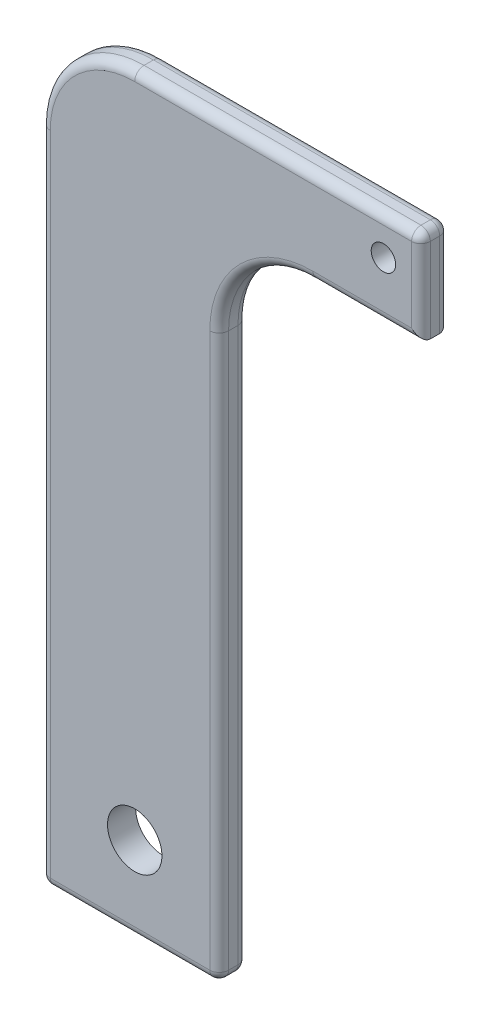
from build123d import *

# Parameters (mm, degrees)
ESQUISSE1_W        = 19
ESQUISSE1_H        = 70
ESQUISSE1_R        = 2.9
ESQUISSE1_H_2      = 10
ESQUISSE1_W_2      = 21.5
ESQUISSE1_R_2      = 1.3
BOSS_EXTRU_1_DEPTH = 3
CONG_1_R           = 10
CONG_2_R           = 1


with BuildPart() as part:
    # Esquisse1 → Boss.-Extru.1 (new body)
    # profile 1 of 3: a face of its own
    with BuildSketch(Plane.XY.offset(23)):
        with Locations((9.5, 112)):
            Rectangle(ESQUISSE1_W, ESQUISSE1_H)
        with Locations((10, 86)):
            Circle(ESQUISSE1_R, mode=Mode.SUBTRACT)
    # profile 2 of 3: a face of its own
    with BuildSketch(Plane.XY.offset(23)):
        with Locations((9.5, 152)):
            Rectangle(ESQUISSE1_W, ESQUISSE1_H_2)
    # profile 3 of 3: a face of its own
    with BuildSketch(Plane.XY.offset(23)):
        with Locations((29.75, 152)):
            Rectangle(ESQUISSE1_W_2, ESQUISSE1_H_2)
        with Locations((36.5, 153)):
            Circle(ESQUISSE1_R_2, mode=Mode.SUBTRACT)
    extrude(amount=BOSS_EXTRU_1_DEPTH)

    # Congé1
    cong_1_edges = [part.edges().sort_by_distance(p)[0] for p in [
        (0, 157, 24.5),
        (19, 147, 24.5),
    ]]
    fillet(cong_1_edges, radius=CONG_1_R)

    # Congé2
    cong_2_edges = [part.edges().sort_by_distance(p)[0] for p in [
        (25.25, 157, 23),
        (40.5, 152, 23),
        (19, 107, 23),
        (9.5, 77, 23),
        (0, 112, 23),
        (9.5, 77, 26),
        (40.5, 157, 24.5),
        (19, 77, 24.5),
        (0, 77, 24.5),
        (19, 107, 26),
        (34.75, 147, 23),
        (34.75, 147, 26),
        (40.5, 152, 26),
        (2.928932188, 154.071067812, 23),
        (2.928932188, 154.071067812, 26),
        (25.25, 157, 26),
        (21.928932188, 144.071067812, 23),
        (21.928932188, 144.071067812, 26),
        (0, 112, 26),
    ]]
    fillet(cong_2_edges, radius=CONG_2_R)


solid = part.part
